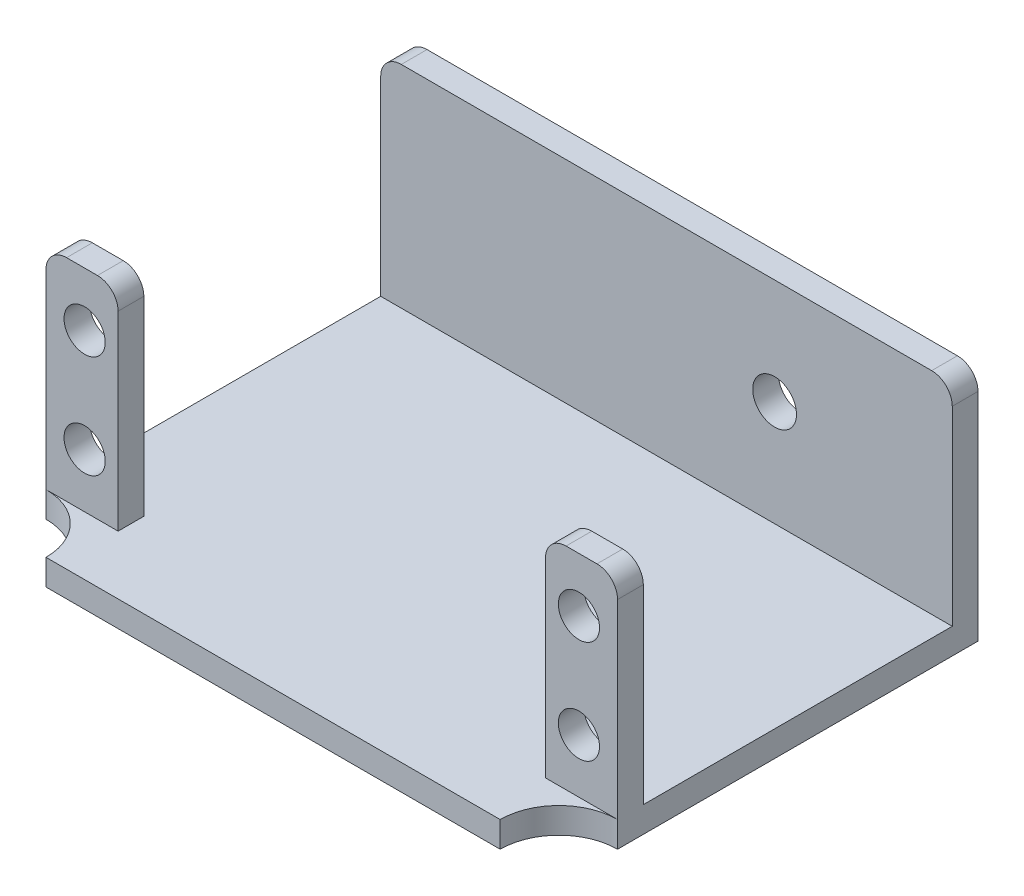
from build123d import *

# Parameters (mm, degrees)
SKETCH1_W                   = 55.5
SKETCH1_H                   = 38.2
BRACKETBASE_DEPTH           = 2.5
SKETCH2_W                   = 7
SKETCH2_H                   = 20.5
SERVOMOUNTINGHOLETABS_DEPTH = 2.5
SKETCH3_R                   = 2
SERVOMOUNTINGHOLES_DEPTH    = 2.5
SKETCH4_W                   = 55.5
SKETCH4_H                   = 2.5
BASEWALL_DEPTH              = 23
SKETCH5_R                   = 2.125
M4MOUNTINGHOLE_DEPTH        = 2.5
SKETCH6_R                   = 5.7
BASETRIM_DEPTH              = 2.5
FILLET1_R                   = 2
SKETCH7_R                   = 2.125
CUT_EXTRUDE1_DEPTH          = 10
BOSS_EXTRUDE1_START         = -2.5
SKETCH8_R                   = 2.125
BOSS_EXTRUDE1_DEPTH         = 2.5


with BuildPart() as part:
    # Sketch1 → bracketBase (new body)
    with BuildSketch(Plane(origin=(0, 0, 0), x_dir=(1, 0, 0), z_dir=(0, 1, 0))):
        with Locations((27.75, 19.1)):
            Rectangle(SKETCH1_W, SKETCH1_H)
    extrude(amount=BRACKETBASE_DEPTH)

    # Sketch2 → servoMountingHoleTabs (add)
    with BuildSketch(Plane.XY.offset(-8.2)):
        with Locations((3.5, 12.75)):
            Rectangle(SKETCH2_W, SKETCH2_H)
        with Locations((52, 12.75)):
            Rectangle(SKETCH2_W, SKETCH2_H)
    extrude(amount=SERVOMOUNTINGHOLETABS_DEPTH)

    # Sketch3 → servoMountingHoles (cut)
    with BuildSketch(Plane.XY.offset(-5.7)):
        with Locations((3.75, 17.75)):
            Circle(SKETCH3_R)
        with Locations(Location((3.75, 7.75, 0), (0, 0, 180))):
            Circle(SKETCH3_R)
        with Locations((51.75, 7.75)):
            Circle(SKETCH3_R)
        with Locations(Location((51.75, 17.75, 0), (0, 0, 180))):
            Circle(SKETCH3_R)
    extrude(amount=-SERVOMOUNTINGHOLES_DEPTH, mode=Mode.SUBTRACT)

    # Sketch4 → baseWall (add)
    with BuildSketch(Plane(origin=(0, 0, 0), x_dir=(1, 0, 0), z_dir=(0, 1, 0))):
        with Locations((27.75, 39.45)):
            Rectangle(SKETCH4_W, SKETCH4_H)
    extrude(amount=BASEWALL_DEPTH)

    # Sketch5 → M4mountingHole (cut)
    with BuildSketch(Plane.XY.offset(-38.2)):
        with Locations((38.25, 12.75)):
            Circle(SKETCH5_R)
    extrude(amount=-M4MOUNTINGHOLE_DEPTH, mode=Mode.SUBTRACT)

    # Sketch6 → baseTrim (cut)
    with BuildSketch(Plane(origin=(0, 2.5, 0), x_dir=(1, 0, 0), z_dir=(0, 1, 0))):
        Circle(SKETCH6_R)
        with Locations((55.5, 0)):
            Circle(SKETCH6_R)
    extrude(amount=-BASETRIM_DEPTH, mode=Mode.SUBTRACT)

    # Fillet1
    fillet1_edges = [part.edges().sort_by_distance(p)[0] for p in [
        (0, 23, -6.95),
        (7, 23, -6.95),
        (55.5, 23, -6.95),
        (48.5, 23, -6.95),
        (55.5, 23, -39.45),
        (0, 23, -39.45),
    ]]
    fillet(fillet1_edges, radius=FILLET1_R)

    # Sketch7 → Cut-Extrude1 (cut)
    with BuildSketch(Plane(origin=(0, 0, -40.7), x_dir=(-1, 0, 0), z_dir=(0, 0, -1))):
        with Locations((-17.25, 12.75)):
            Circle(SKETCH7_R)
    extrude(amount=-CUT_EXTRUDE1_DEPTH, mode=Mode.SUBTRACT)

    # Sketch8 → Boss-Extrude1 (add)
    with BuildSketch(Plane.XY.offset(-38.2).offset(BOSS_EXTRUDE1_START)):
        with Locations((17.25, 12.75)):
            Circle(SKETCH8_R)
    extrude(amount=BOSS_EXTRUDE1_DEPTH)


solid = part.part
